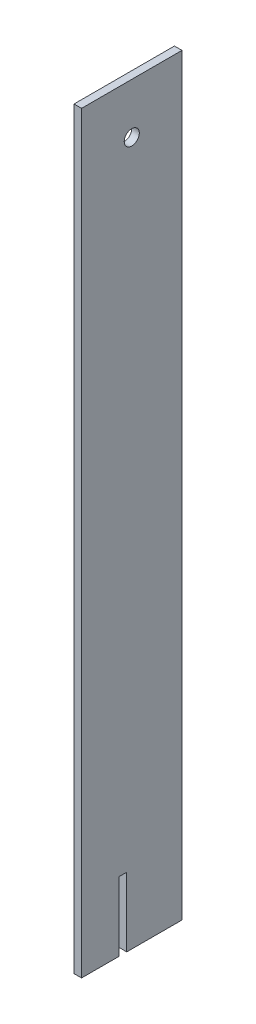
from build123d import *

# Parameters (mm, degrees)
SKETCH1_W           = 40
SKETCH1_H           = 300
BOSS_EXTRUDE1_DEPTH = 3
SKETCH2_R           = 3
CUT_EXTRUDE1_DEPTH  = 3
SKETCH3_W           = 3
SKETCH3_H           = 27.5
CUT_EXTRUDE2_DEPTH  = 3


with BuildPart() as part:
    # Sketch1 → Boss-Extrude1 (new body)
    with BuildSketch(Plane(origin=(0, 0, 0), x_dir=(0, 0, -1), z_dir=(1, 0, 0))):
        Rectangle(SKETCH1_W, SKETCH1_H)
    extrude(amount=BOSS_EXTRUDE1_DEPTH)

    # Sketch2 → Cut-Extrude1 (cut)
    with BuildSketch(Plane(origin=(3, 0, 0), x_dir=(0, 0, -1), z_dir=(1, 0, 0))):
        with Locations((0, 130)):
            Circle(SKETCH2_R)
    extrude(amount=-CUT_EXTRUDE1_DEPTH, mode=Mode.SUBTRACT)

    # Sketch3 → Cut-Extrude2 (cut)
    with BuildSketch(Plane(origin=(3, 0, 0), x_dir=(0, 0, -1), z_dir=(1, 0, 0))):
        with Locations((-3.5, -136.25)):
            Rectangle(SKETCH3_W, SKETCH3_H)
    extrude(amount=-CUT_EXTRUDE2_DEPTH, mode=Mode.SUBTRACT)


solid = part.part
